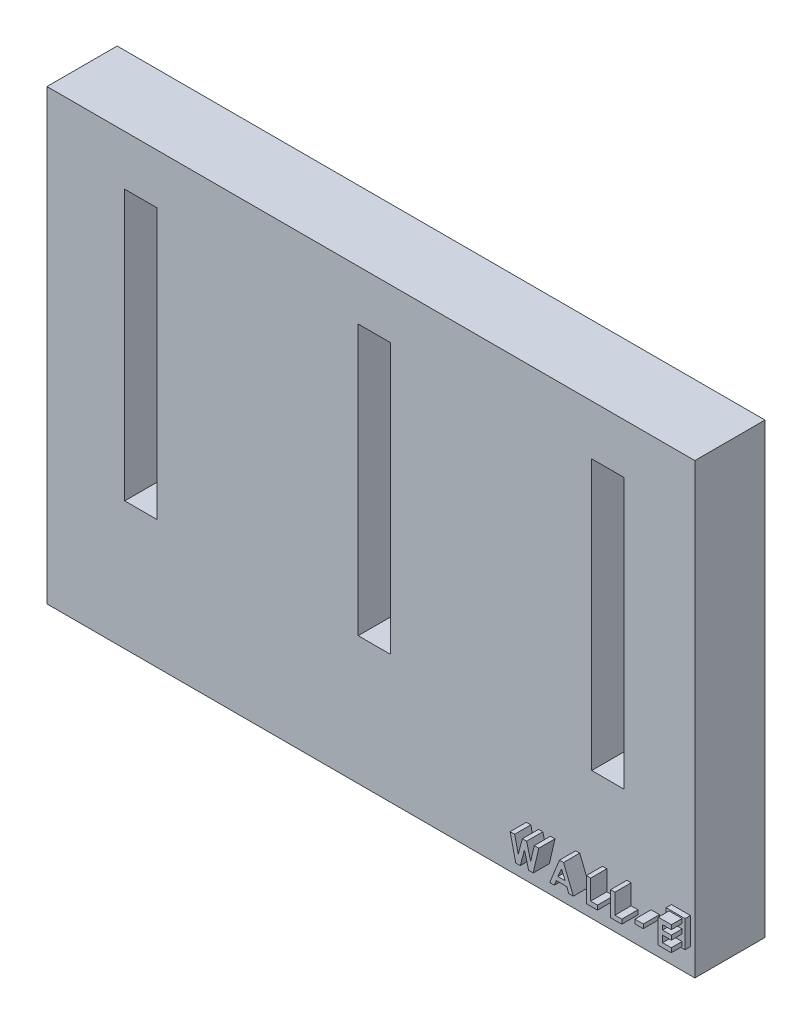
from build123d import *

# Parameters (mm, degrees)
SKETCH1_W           = 120
SKETCH1_H           = 83
BOSS_EXTRUDE1_DEPTH = 13
SKETCH2_W           = 6
SKETCH2_H           = 50
CUT_EXTRUDE1_DEPTH  = 6
SKETCH4_W           = 1.557692307
SKETCH4_H           = 0.75
BOSS_EXTRUDE3_DEPTH = 3
SKETCH5_W           = 3.5
SKETCH5_H           = 5
BOSS_EXTRUDE4_DEPTH = 1


with BuildPart() as part:
    # Sketch1 → Boss-Extrude1 (new body)
    with BuildSketch(Plane.XY):
        Rectangle(SKETCH1_W, SKETCH1_H)
    extrude(amount=BOSS_EXTRUDE1_DEPTH)

    # Sketch2 → Cut-Extrude1 (cut)
    with BuildSketch(Plane.XY.offset(13)):
        with Locations((-42.602242675, 7.231357776)):
            Rectangle(SKETCH2_W, SKETCH2_H)
        with Locations((0.647757325, 7.231357776)):
            Rectangle(SKETCH2_W, SKETCH2_H)
        with Locations((43.897757325, 7.231357776)):
            Rectangle(SKETCH2_W, SKETCH2_H)
    extrude(amount=-CUT_EXTRUDE1_DEPTH, mode=Mode.SUBTRACT)

    # Sketch4 → Boss-Extrude3 (add)
    # profile 1 of 6: a face of its own
    with BuildSketch(Plane.XY.offset(13)):
        Polygon((28.787603371, -32.130057538), (29.621437506, -32.130057538), (30.287603371, -35.002954173), (31.051125006, -32.130057538), (31.834478371, -32.130057538), (32.595295679, -35.002954173), (33.257855775, -32.130057538), (34.095295679, -32.130057538), (33.055031256, -36.630057538), (32.211281256, -36.630057538), (31.441449525, -33.721103211), (30.668012025, -36.630057538), (29.830572121, -36.630057538), align=None)
    # profile 2 of 6: a face of its own
    with BuildSketch(Plane.XY.offset(13)):
        Polygon((37.930932698, -32.130057538), (38.68183414, -32.130057538), (40.499141833, -36.630057538), (39.636461544, -36.630057538), (39.286701929, -35.706980615), (37.327867794, -35.706980615), (36.977206736, -36.630057538), (36.114526448, -36.630057538), align=None)
        Polygon((38.30683414, -33.337088788), (37.634358179, -34.899288307), (38.980211544, -34.899288307), align=None, mode=Mode.SUBTRACT)
    # profile 3 of 6: a face of its own
    with BuildSketch(Plane.XY.offset(13)):
        Polygon((42.893372602, -32.130057538), (43.701064909, -32.130057538), (43.701064909, -35.82236523), (44.970295679, -35.82236523), (44.970295679, -36.630057538), (42.893372602, -36.630057538), align=None)
    # profile 4 of 6: a face of its own
    with BuildSketch(Plane.XY.offset(13)):
        Polygon((47.393372602, -32.130057538), (48.201064909, -32.130057538), (48.201064909, -35.82236523), (49.470295679, -35.82236523), (49.470295679, -36.630057538), (47.393372602, -36.630057538), align=None)
    # profile 5 of 6: a face of its own
    with BuildSketch(Plane.XY.offset(13)):
        with Locations((52.672218756, -34.985826769)):
            Rectangle(SKETCH4_W, SKETCH4_H)
    # profile 6 of 6: a face of its own
    with BuildSketch(Plane.XY.offset(13)):
        Polygon((56.220295679, -32.130057538), (58.643372602, -32.130057538), (58.643372602, -32.937749846), (57.027987986, -32.937749846), (57.027987986, -33.803134461), (58.643372602, -33.803134461), (58.643372602, -34.610826769), (57.027987986, -34.610826769), (57.027987986, -35.82236523), (58.643372602, -35.82236523), (58.643372602, -36.630057538), (56.220295679, -36.630057538), align=None)
    extrude(amount=BOSS_EXTRUDE3_DEPTH)

    # Sketch5 → Boss-Extrude4 (add)
    with BuildSketch(Plane.XY.offset(13)):
        with Locations((57.43183414, -34.380057538)):
            Rectangle(SKETCH5_W, SKETCH5_H)
    extrude(amount=BOSS_EXTRUDE4_DEPTH)


solid = part.part
